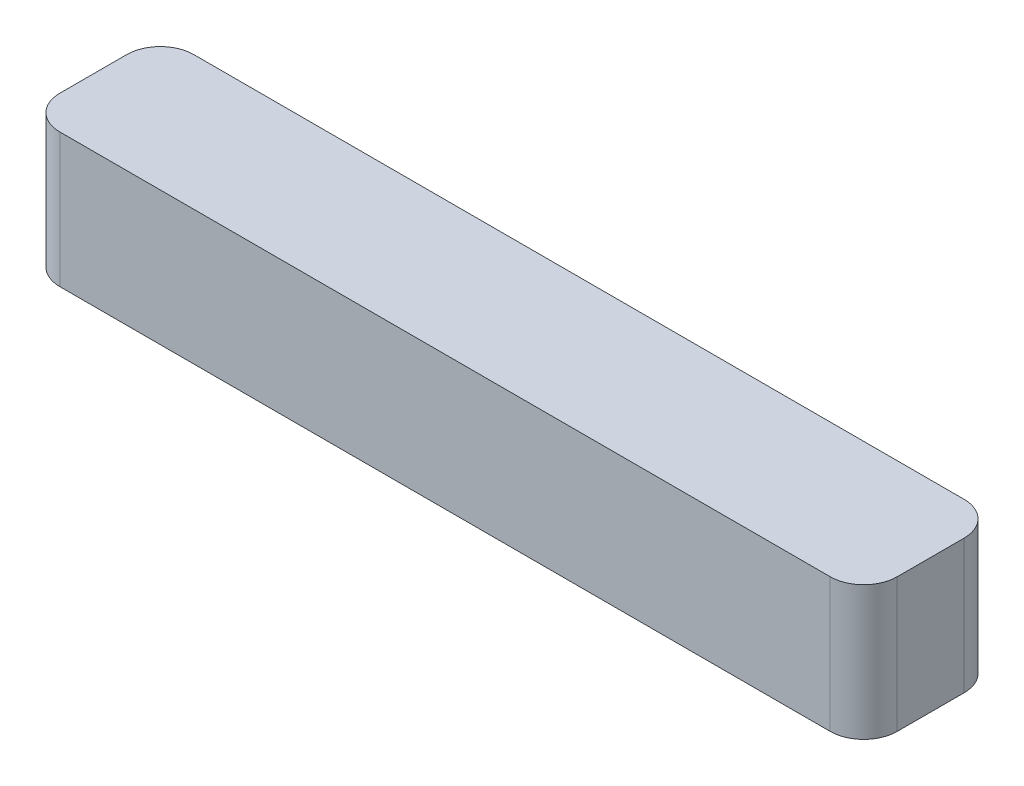
from build123d import *

# Parameters (mm, degrees)
BOSS_EXTRUDE1_DEPTH = 4


with BuildPart() as part:
    # Sketch1 → Boss-Extrude1 (new body)
    with BuildSketch(Plane(origin=(0, 0, 0), x_dir=(1, 0, 0), z_dir=(0, 1, 0))):
        with BuildLine():
            Line((-11.5, 2), (11.5, 2))
            ThreePointArc((11.5, 2), (12.207106781, 1.707106781), (12.5, 1))
            Line((12.5, 1), (12.5, -1))
            ThreePointArc((12.5, -1), (12.207106781, -1.707106781), (11.5, -2))
            Line((11.5, -2), (-11.5, -2))
            ThreePointArc((-11.5, -2), (-12.207106781, -1.707106781), (-12.5, -1))
            Line((-12.5, -1), (-12.5, 1))
            ThreePointArc((-12.5, 1), (-12.207106781, 1.707106781), (-11.5, 2))
        make_face()
    extrude(amount=BOSS_EXTRUDE1_DEPTH)


solid = part.part
